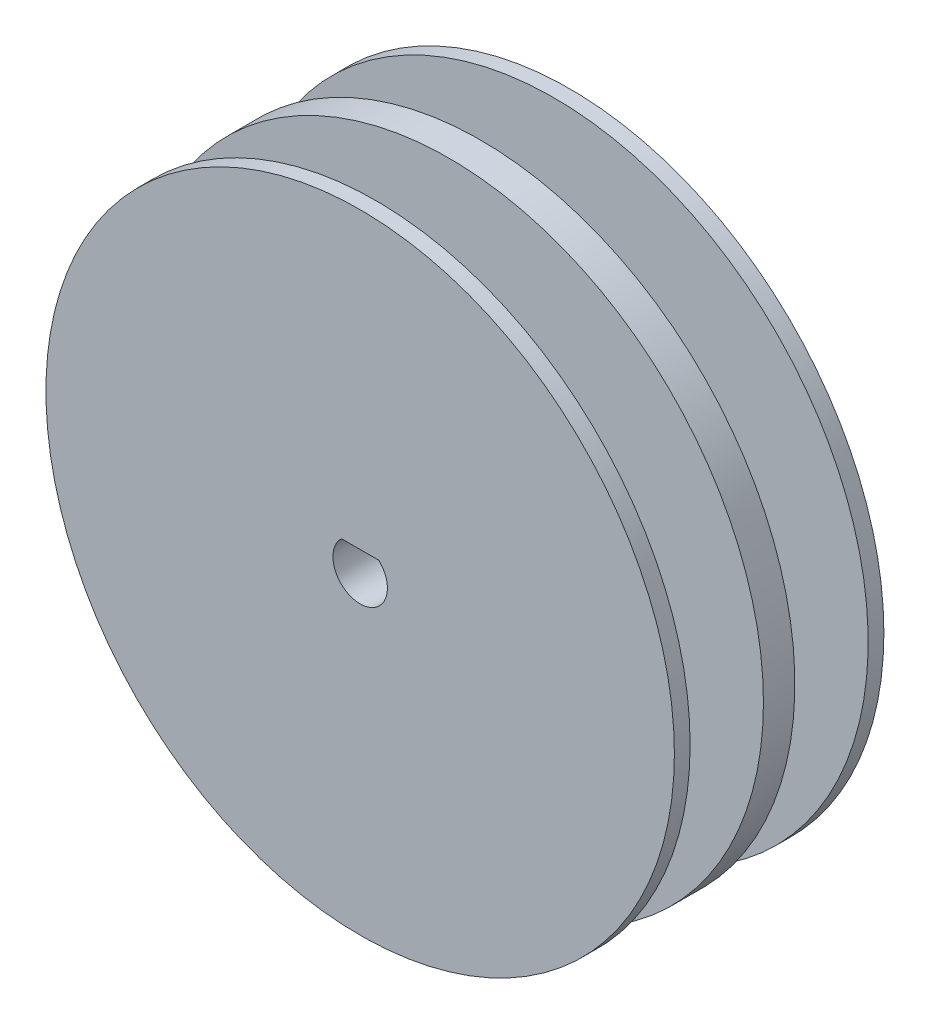
from build123d import *

# Parameters (mm, degrees)
SKETCH1_R               = 30
SKETCH1_R_2             = 20
BOSS_EXTRUDE1_DEPTH     = 10
SKETCH2_OUTSIDE_W       = 79.436
SKETCH2_OUTSIDE_H       = 79.436
SKETCH2_OUTSIDE_R       = 20
CUT_EXTRUDE1_DEPTH      = 3.5
CUT_EXTRUDE2_DEPTH      = 44.588989435
CUT_EXTRUDE2_DEPTH_BACK = 44.588989435
SKETCH3_R               = 1.6
CUT_EXTRUDE3_DEPTH      = 47.904157598
CUT_EXTRUDE3_DEPTH_BACK = 47.904157598


with BuildPart() as part:
    # Sketch1 → Boss-Extrude1 (new, symmetric)
    # profile 1 of 2: a face of its own
    with BuildSketch(Plane.XY):
        Circle(SKETCH1_R)
        Circle(SKETCH1_R_2, mode=Mode.SUBTRACT)
    # profile 2 of 2: a face of its own
    with BuildSketch(Plane.XY):
        Circle(SKETCH1_R_2)
    extrude(amount=BOSS_EXTRUDE1_DEPTH, both=True)

    # Sketch2 outside → Cut-Extrude1 (cut, symmetric)
    with BuildSketch(Plane.XY.offset(5)):
        Rectangle(SKETCH2_OUTSIDE_W, SKETCH2_OUTSIDE_H)
        Circle(SKETCH2_OUTSIDE_R, mode=Mode.SUBTRACT)
    cut_extrude1 = extrude(amount=CUT_EXTRUDE1_DEPTH, both=True, mode=Mode.SUBTRACT)

    # Mirror1: Cut-Extrude1 across plane
    add(cut_extrude1.mirror(Plane.XY), mode=Mode.SUBTRACT)

    # Sketch3 → Cut-Extrude2 (cut, two sides: drawn at the far end of the back side and taken through both)
    with BuildSketch(Plane(origin=(0, 0, 0), x_dir=(0, 0, -1), z_dir=(1, 0, 0)).offset(-CUT_EXTRUDE2_DEPTH_BACK)):
        with Locations((-5, 10)):
            Circle(SKETCH3_R)
        with Locations((5, 10)):
            Circle(SKETCH3_R)
    extrude(amount=CUT_EXTRUDE2_DEPTH + CUT_EXTRUDE2_DEPTH_BACK, mode=Mode.SUBTRACT)

    # Sketch4 → Cut-Extrude3 (cut, two sides: drawn at the far end of the back side and taken through both)
    with BuildSketch(Plane(origin=(0, 0, -10), x_dir=(-1, 0, 0), z_dir=(0, 0, -1)).offset(-CUT_EXTRUDE3_DEPTH_BACK)):
        with BuildLine():
            Line((-1.774823935, 1.9), (1.774823935, 1.9))
            ThreePointArc((1.774823935, 1.9), (0, -2.6), (-1.774823935, 1.9))
        make_face()
    extrude(amount=CUT_EXTRUDE3_DEPTH + CUT_EXTRUDE3_DEPTH_BACK, mode=Mode.SUBTRACT)


solid = part.part
